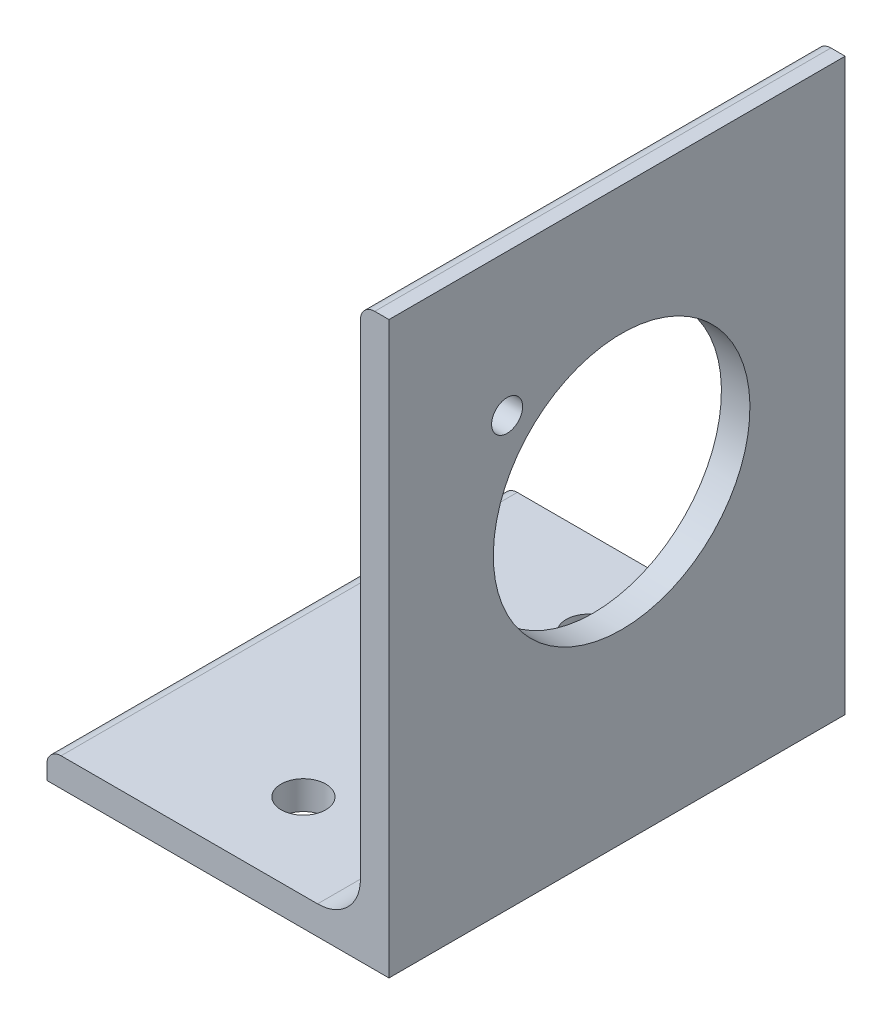
from build123d import *

# Parameters (mm, degrees)
BOSS_EXTRUDE1_DEPTH = 25.4
SKETCH3_R           = 14.2875
SKETCH3_R_2         = 1.7272
CUT_EXTRUDE1_DEPTH  = 54.600169076
SKETCH9_R           = 2.4892
CUT_EXTRUDE2_DEPTH  = 71.995158286


with BuildPart() as part:
    # Sketch2 → Boss-Extrude1 (new, symmetric)
    with BuildSketch(Plane.XY):
        with BuildLine():
            Line((-19.05, -31.75), (19.05, -31.75))
            Line((19.05, -31.75), (19.05, 31.75))
            Line((19.05, 31.75), (17.4625, 31.75))
            ThreePointArc((17.4625, 31.75), (16.339967985, 31.285032015), (15.875, 30.1625))
            Line((15.875, 30.1625), (15.875, -23.7998))
            ThreePointArc((15.875, -23.7998), (14.476376302, -27.176376302), (11.0998, -28.575))
            Line((11.0998, -28.575), (-17.4625, -28.575))
            ThreePointArc((-17.4625, -28.575), (-18.585032015, -29.039967985), (-19.05, -30.1625))
            Line((-19.05, -30.1625), (-19.05, -31.75))
        make_face()
    extrude(amount=BOSS_EXTRUDE1_DEPTH, both=True)

    # Sketch3 → Cut-Extrude1 (cut, through all)
    with BuildSketch(Plane.ZY.offset(-15.875)):
        with Locations(Location((-0.50799991, 3.175, 0), (0, 0, 270))):
            Circle(SKETCH3_R)
        with Locations(Location((12.243963782, 15.926963692, 0), (0, 0, 270))):
            Circle(SKETCH3_R_2)
    extrude(amount=-CUT_EXTRUDE1_DEPTH, mode=Mode.SUBTRACT)

    # Sketch9 → Cut-Extrude2 (cut, through all)
    with BuildSketch(Plane.XZ.offset(31.75)):
        with Locations((0, 15.875)):
            Circle(SKETCH9_R)
        with Locations((0, -15.875)):
            Circle(SKETCH9_R)
    extrude(amount=-CUT_EXTRUDE2_DEPTH, mode=Mode.SUBTRACT)


solid = part.part
